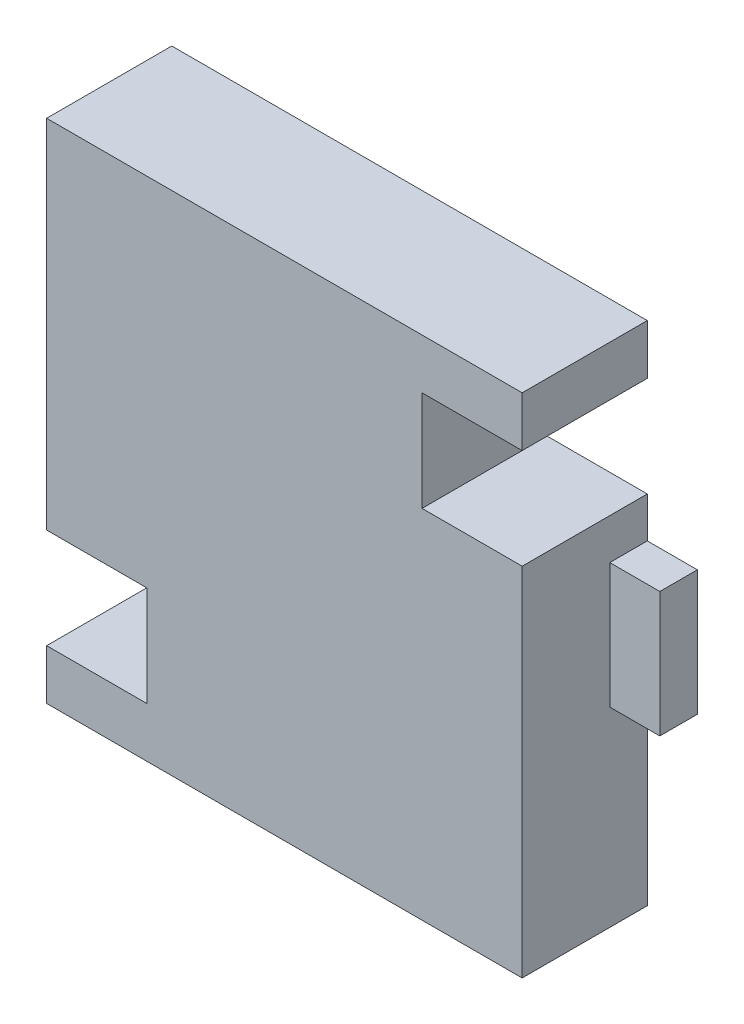
from build123d import *

# Parameters (mm, degrees)
EXTRUDE_1_DEPTH = 3
EXTRUDE_2_DEPTH = 7


with BuildPart() as part:
    # 草图1 → 凸台-拉伸1 (new body)
    with BuildSketch(Plane.XY):
        Polygon((0, 0), (0, -15.25), (-4, -15.25), (-4, -25.25), (0, -25.25), (0, -28.5), (8, -28.5), (8, -36.5), (0, -36.5), (0, -40.5), (38, -40.5), (38, -25.25), (42, -25.25), (42, -15.25), (38, -15.25), (38, -12), (30, -12), (30, -4), (38, -4), (38, 0), align=None)
    extrude(amount=EXTRUDE_1_DEPTH)

    # 草图2 → 凸台-拉伸2 (add)
    with BuildSketch(Plane.XY.offset(3)):
        Polygon((0, 0), (0, -28.5), (8, -28.5), (8, -36.5), (0, -36.5), (0, -40.5), (38, -40.5), (38, -12), (30, -12), (30, -4), (38, -4), (38, 0), align=None)
    extrude(amount=EXTRUDE_2_DEPTH)


solid = part.part
